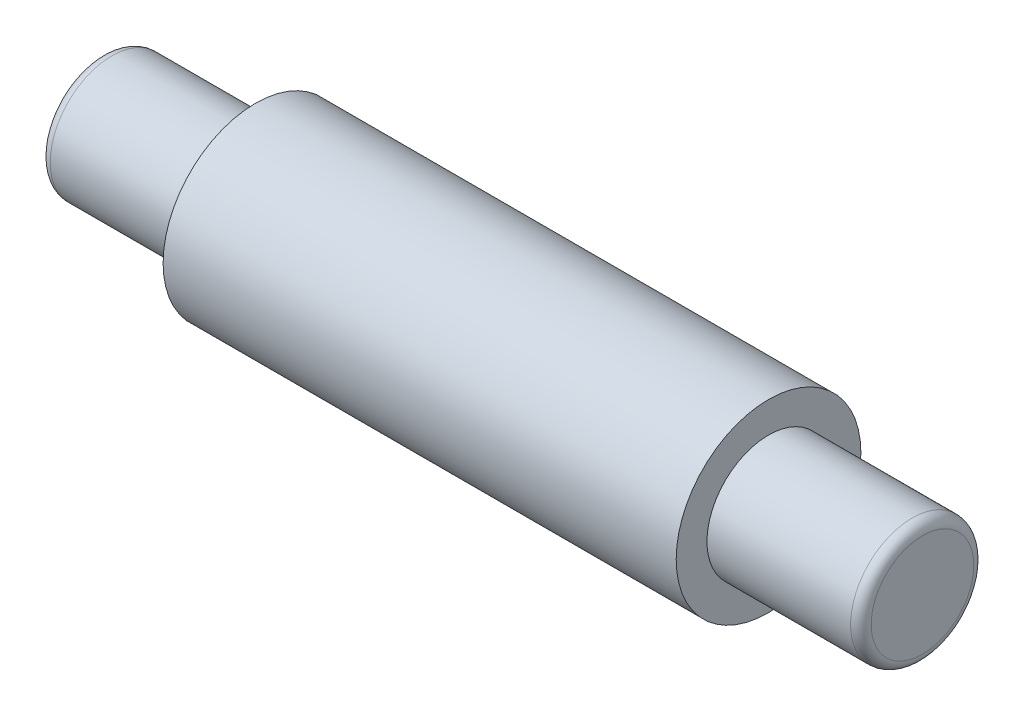
from build123d import *

# Parameters (mm, degrees)
SKETCH1_R           = 9
BOSS_EXTRUDE1_DEPTH = 50
SKETCH2_R           = 6
BOSS_EXTRUDE2_DEPTH = 15
BOSS_EXTRUDE3_START = 15
SKETCH3_R           = 6
BOSS_EXTRUDE3_DEPTH = 15
FILLET1_R           = 1
FILLET2_R           = 1


with BuildPart() as part:
    # Sketch1 → Boss-Extrude1 (new body)
    with BuildSketch(Plane(origin=(0, 0, 0), x_dir=(0, 0, -1), z_dir=(1, 0, 0))):
        Circle(SKETCH1_R)
    extrude(amount=BOSS_EXTRUDE1_DEPTH)

    # Sketch2 → Boss-Extrude2 (add)
    with BuildSketch(Plane(origin=(50, 0, 0), x_dir=(0, 0, -1), z_dir=(1, 0, 0))):
        Circle(SKETCH2_R)
    extrude(amount=BOSS_EXTRUDE2_DEPTH)

    # Sketch3 → Boss-Extrude3 (add)
    with BuildSketch(Plane.ZY.offset(BOSS_EXTRUDE3_START)):
        with Locations(Location((0, 0, 0), (0, 0, 180))):
            Circle(SKETCH3_R)
    extrude(amount=-BOSS_EXTRUDE3_DEPTH)

    # Fillet1
    fillet1_edges = [part.edges().sort_by_distance(p)[0] for p in [
        (-15, 0, 6),
    ]]
    fillet(fillet1_edges, radius=FILLET1_R)

    # Fillet2
    fillet2_edges = [part.edges().sort_by_distance(p)[0] for p in [
        (65, 0, 6),
    ]]
    fillet(fillet2_edges, radius=FILLET2_R)


solid = part.part
